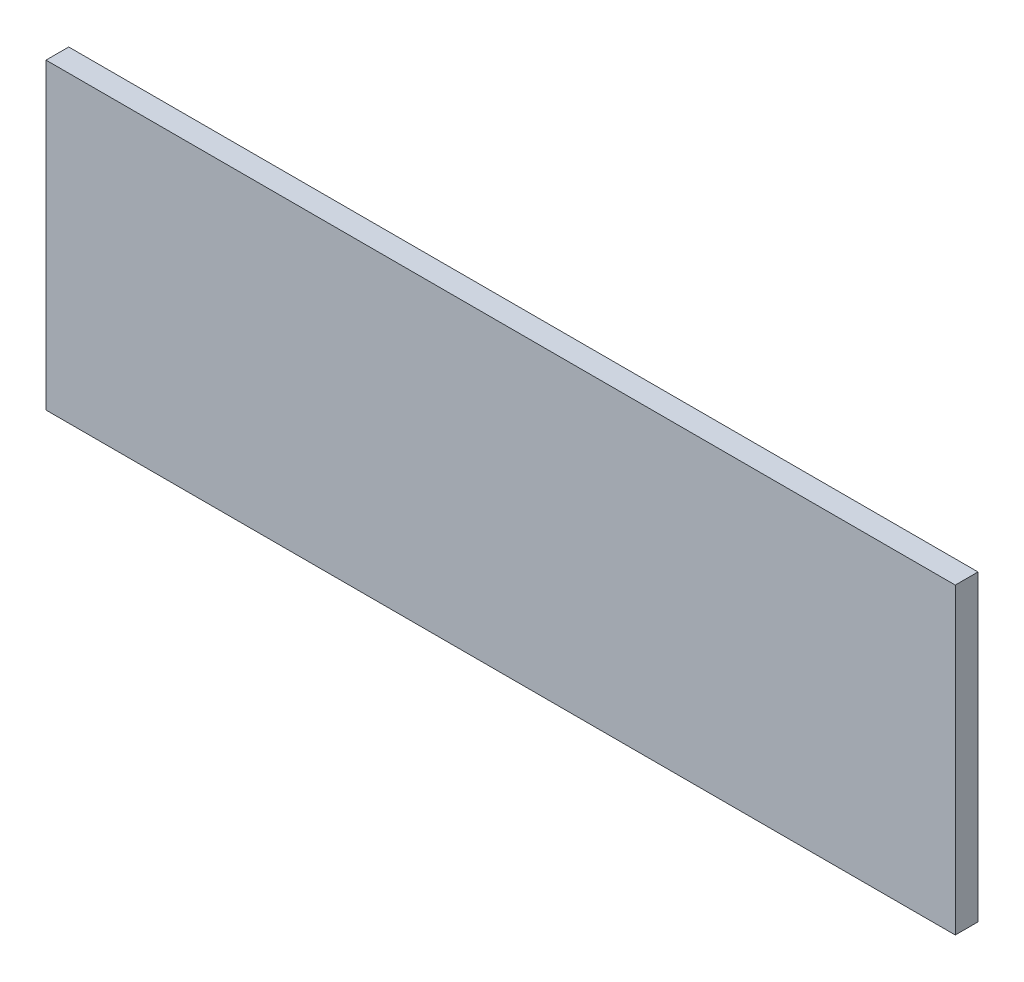
from build123d import *

# Parameters (mm, degrees)
SKETCH_1_W      = 12000
SKETCH_1_H      = 4000
EXTRUDE_1_DEPTH = 300


with BuildPart() as part:
    # 草图1 → 凸台-拉伸1 (new body)
    with BuildSketch(Plane.XY):
        Rectangle(SKETCH_1_W, SKETCH_1_H)
    extrude(amount=EXTRUDE_1_DEPTH)


solid = part.part
